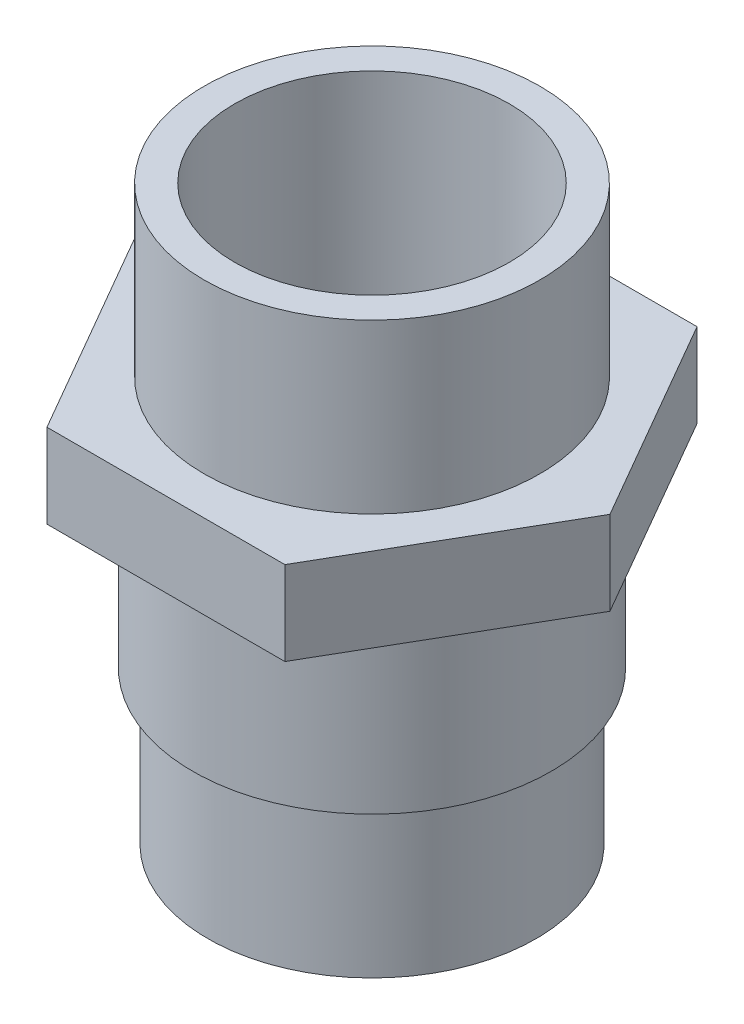
from build123d import *
from build123d.topology import SkipClean

# Parameters (mm, degrees)
SKIZZE1_R                       = 11
SKIZZE1_R_2                     = 9
AUFSATZ_LINEAR_AUSTRAGEN1_DEPTH = 11
AUFSATZ_LINEAR_START            = 5.5
SKIZZE2_R                       = 9
AUFSATZ_LINEAR_AUSTRAGEN2_DEPTH = 5.5
AUFSATZ_LINEAR_START_2          = 11
SKIZZE3_R                       = 11.75
SKIZZE3_R_2                     = 9
AUFSATZ_LINEAR_AUSTRAGEN3_DEPTH = 11
SKIZZE4_R                       = 10.75
SKIZZE4_R_2                     = 7
AUFSATZ_LINEAR_AUSTRAGEN4_DEPTH = 10


with BuildPart() as part:
    # Skizze1 → Aufsatz-Linear austragen1 (new body)
    with BuildSketch(Plane(origin=(0, 0, 0), x_dir=(1, 0, 0), z_dir=(0, 1, 0))):
        with Locations(Location((0, 0, 0), (0, 0, 270))):
            Circle(SKIZZE1_R)
        with Locations(Location((0, 0, 0), (0, 0, 270))):
            Circle(SKIZZE1_R_2, mode=Mode.SUBTRACT)
    extrude(amount=AUFSATZ_LINEAR_AUSTRAGEN1_DEPTH)

    # Skizze2 → Aufsatz-Linear austragen2 (add)
    with SkipClean():  # the faces are left unmerged after this step: merging them gives an invalid solid
        with BuildSketch(Plane.XZ.offset(AUFSATZ_LINEAR_START)):
            Polygon((15.588457268, 0), (7.794228634, 13.5), (-7.794228634, 13.5), (-15.588457268, 0), (-7.794228634, -13.5), (7.794228634, -13.5), align=None)
            with Locations(Location((0, 0, 0), (0, 0, 270))):
                Circle(SKIZZE2_R, mode=Mode.SUBTRACT)
        extrude(amount=-AUFSATZ_LINEAR_AUSTRAGEN2_DEPTH)

    # Skizze3 → Aufsatz-Linear austragen3 (add)
    with SkipClean():  # the faces are left unmerged after this step: merging them gives an invalid solid
        with BuildSketch(Plane.XZ.offset(5.5).offset(AUFSATZ_LINEAR_START_2)):
            with Locations(Location((0, 0, 0), (0, 0, 270))):
                Circle(SKIZZE3_R)
            with Locations(Location((0, 0, 0), (0, 0, 270))):
                Circle(SKIZZE3_R_2, mode=Mode.SUBTRACT)
        extrude(amount=-AUFSATZ_LINEAR_AUSTRAGEN3_DEPTH)

    # Skizze4 → Aufsatz-Linear austragen4 (add)
    with SkipClean():  # the faces are left unmerged after this step: merging them gives an invalid solid
        with BuildSketch(Plane.XZ.offset(16.5)):
            with Locations(Location((0, 0, 0), (0, 0, 270))):
                Circle(SKIZZE4_R)
            with Locations(Location((0, 0, 0), (0, 0, 270))):
                Circle(SKIZZE4_R_2, mode=Mode.SUBTRACT)
        extrude(amount=AUFSATZ_LINEAR_AUSTRAGEN4_DEPTH)


solid = part.part
